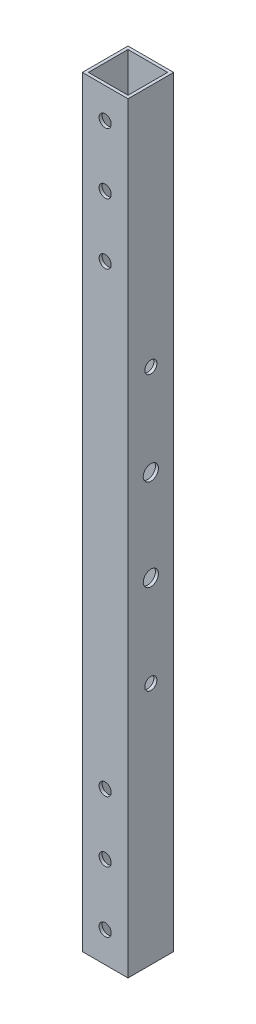
from build123d import *

# Parameters (mm, degrees)
SKETCH_1_W          = 15
SKETCH_1_H          = 15
SKETCH_1_W_2        = 13
SKETCH_1_H_2        = 13
EXTRUDE_1_DEPTH     = 250
SKETCH_3_R          = 2
CUT_EXTRUDE_2_DEPTH = 251.561868607
SKETCH_5_R          = 2.5
SKETCH_5_R_2        = 2
CUT_EXTRUDE_4_DEPTH = 251.561868607


with BuildPart() as part:
    # 草图1 → 凸台-拉伸1 (new body)
    with BuildSketch(Plane(origin=(0, 0, 0), x_dir=(1, 0, 0), z_dir=(0, 1, 0))):
        Rectangle(SKETCH_1_W, SKETCH_1_H)
        Rectangle(SKETCH_1_W_2, SKETCH_1_H_2, mode=Mode.SUBTRACT)
    extrude(amount=EXTRUDE_1_DEPTH)

    # 草图3 → 切除-拉伸2 (cut, through all)
    with BuildSketch(Plane.XY.offset(7.5)):
        with Locations((0, 240)):
            Circle(SKETCH_3_R)
        with Locations((0, 220)):
            Circle(SKETCH_3_R)
        with Locations(Location((0, 30, 0), (0, 0, 180))):
            Circle(SKETCH_3_R)
        with Locations(Location((0, 10, 0), (0, 0, 180))):
            Circle(SKETCH_3_R)
        with Locations((0, 200)):
            Circle(SKETCH_3_R)
        with Locations(Location((0, 50, 0), (0, 0, 180))):
            Circle(SKETCH_3_R)
    extrude(amount=-CUT_EXTRUDE_2_DEPTH, mode=Mode.SUBTRACT)

    # 草图5 → 切除-拉伸4 (cut, through all)
    with BuildSketch(Plane(origin=(7.5, 0, 0), x_dir=(0, 0, -1), z_dir=(1, 0, 0))):
        with Locations((0, 140)):
            Circle(SKETCH_5_R)
        with Locations((0, 110)):
            Circle(SKETCH_5_R)
        with Locations((0, 170)):
            Circle(SKETCH_5_R_2)
        with Locations((0, 80)):
            Circle(SKETCH_5_R_2)
    extrude(amount=-CUT_EXTRUDE_4_DEPTH, mode=Mode.SUBTRACT)


solid = part.part
